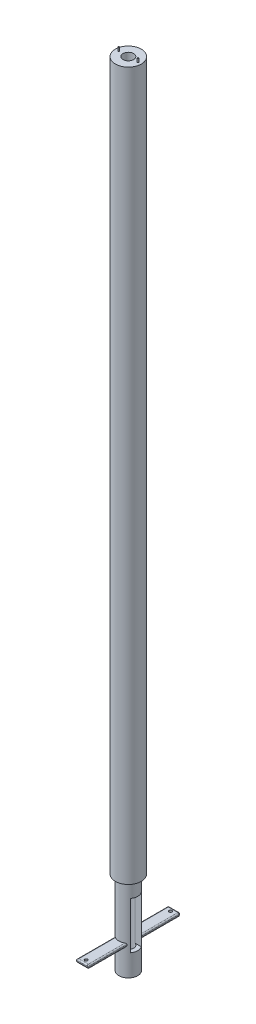
from build123d import *

# Parameters (mm, degrees)
SWEEP3_PROFILE_R         = 4
SWEEP4_PROFILE_R         = 5.5
SKETCH45_R               = 2.25
CUT_EXTRUDE2_DEPTH       = 337.377466094
SWEEP5_PROFILE_R         = 0.25
SWEEP6_PROFILE_R         = 0.25
SKETCH72_W               = 4.5
SKETCH72_H               = 20
CUT_EXTRUDE6_DEPTH       = 20
BOSS_EXTRUDE1_DEPTH      = 2.5
BOSS_EXTRUDE1_DEPTH_BACK = 2.5
BOSS_EXTRUDE3_DEPTH      = 2.5
BOSS_EXTRUDE3_DEPTH_BACK = 2.5
SKETCH76_4_W             = 16.5
SKETCH76_4_H             = 1.4
SKETCH77_R               = 0.612238256
CUT_EXTRUDE7_DEPTH       = 20
FILLET1_R                = 0.5
CUT_EXTRUDE9_DEPTH       = 3
CUT_EXTRUDE9_DEPTH_BACK  = 3


with BuildPart() as part:
    # Sweep3: sweep along a path in Sketch31
    with BuildLine(Plane.XY) as sweep3_path:
        Line((0, 0), (0, 35.470165431))
    # Sweep3 profile (on start of the path) → Sweep3 (sweep)
    with BuildSketch(Plane.ZX):
        Circle(SWEEP3_PROFILE_R)
    sweep(path=sweep3_path.line)

    # Sweep4: sweep along a path in Sketch38
    with BuildLine(Plane.XY) as sweep4_path:
        Line((0, 35.470165431), (0, 336.287525335))
    # Sweep4 profile (on start of the path) → Sweep4 (sweep)
    with BuildSketch(Plane.ZX.offset(35.470165431)):
        Circle(SWEEP4_PROFILE_R)
    sweep(path=sweep4_path.line)

    # Sketch45 → Cut-Extrude2 (cut, through all)
    with BuildSketch(Plane(origin=(0, 0, 0), x_dir=(1, 0, 0), z_dir=(0, 1, 0))):
        Circle(SKETCH45_R)
    extrude(amount=CUT_EXTRUDE2_DEPTH, mode=Mode.SUBTRACT)

    # Sweep5: sweep along a curve in space
    with BuildLine() as sweep5_path:
        Line((4.125, 336.287525335, 5.531e-06), (4.125, 337.787525335, 5.531e-06))
    # Sweep5 profile (on start of the path) → Sweep5 (sweep)
    with BuildSketch(Plane(origin=(4.125, 336.287525335, 5.531e-06), x_dir=(0, 0, 1), z_dir=(0, 1, 0))):
        Circle(SWEEP5_PROFILE_R)
    sweep(path=sweep5_path.line)

    # Sweep6: sweep along a curve in space
    with BuildLine() as sweep6_path:
        Line((-4.125, 336.287525335, 9.31e-07), (-4.125, 337.787525335, 9.31e-07))
    # Sweep6 profile (on start of the path) → Sweep6 (sweep)
    with BuildSketch(Plane(origin=(-4.125, 336.287525335, 9.31e-07), x_dir=(0, 0, 1), z_dir=(0, 1, 0))):
        Circle(SWEEP6_PROFILE_R)
    sweep(path=sweep6_path.line)

    # Sketch72 → Cut-Extrude6 (cut)
    with BuildSketch(Plane(origin=(0, 0, 0), x_dir=(0, 0, -1), z_dir=(1, 0, 0))):
        with Locations((-0.068000409, 19.236124066)):
            Rectangle(SKETCH72_W, SKETCH72_H)
    extrude(amount=CUT_EXTRUDE6_DEPTH, mode=Mode.SUBTRACT)

    # Sketch76 → Boss-Extrude1 (add, two sides: drawn at the far end of the back side and taken through both)
    with BuildSketch(Plane(origin=(0, 0, 0), x_dir=(0, 0, -1), z_dir=(1, 0, 0)).offset(-BOSS_EXTRUDE1_DEPTH_BACK)):
        Polygon((-3, 12.070165431), (-3, 12.770165431), (-19.5, 12.770165431), (-19.5, 12.370165431), (-19.5, 11.370165431), (-3, 11.370165431), align=None)
    extrude(amount=BOSS_EXTRUDE1_DEPTH + BOSS_EXTRUDE1_DEPTH_BACK)

    # Sketch76<4> → Boss-Extrude3 (add, two sides: drawn at the far end of the back side and taken through both)
    with BuildSketch(Plane(origin=(0, 0, 0), x_dir=(0, 0, -1), z_dir=(1, 0, 0)).offset(-BOSS_EXTRUDE3_DEPTH_BACK)):
        with Locations((11.25, 12.070165431)):
            Rectangle(SKETCH76_4_W, SKETCH76_4_H)
    extrude(amount=BOSS_EXTRUDE3_DEPTH + BOSS_EXTRUDE3_DEPTH_BACK)

    # Sketch77 → Cut-Extrude7 (cut)
    with BuildSketch(Plane(origin=(0, 0, 0), x_dir=(1, 0, 0), z_dir=(0, 1, 0))):
        with Locations((0, 17.9)):
            Circle(SKETCH77_R)
        with Locations((0, -17.9)):
            Circle(SKETCH77_R)
    extrude(amount=CUT_EXTRUDE7_DEPTH, mode=Mode.SUBTRACT)

    # Fillet1
    fillet1_edges = [part.edges().sort_by_distance(p)[0] for p in [
        (-2.5, 12.770165431, 11.3112495),
        (-2.5, 11.370165431, 11.3112495),
        (2.5, 12.070165431, 19.5),
        (0, 11.370165431, 19.5),
        (2.5, 11.370165431, 11.3112495),
        (2.5, 12.770165431, 11.3112495),
        (0, 12.770165431, 19.5),
        (-2.5, 11.370165431, -11.3112495),
        (-2.5, 12.770165431, -11.3112495),
        (0, 12.770165431, -19.5),
        (0, 11.370165431, -19.5),
        (2.5, 12.070165431, -19.5),
        (2.5, 11.370165431, -11.3112495),
        (2.5, 12.770165431, -11.3112495),
    ]]
    fillet(fillet1_edges, radius=FILLET1_R)

    # Sketch81 → Cut-Extrude9 (cut, two sides: drawn at the far end of the back side and taken through both)
    with BuildSketch(Plane.XY.offset(-CUT_EXTRUDE9_DEPTH_BACK)):
        Polygon((-3.370825875, 247.178368204), (-51.601612029, 269.074039778), (-3.592025731, 269.074039778), (-3.592025731, 274.074039778), (-49.327088533, 274.074039778), (-55.247485048, 261.387475818), (-3.370825875, 237.178368204), align=None)
    extrude(amount=CUT_EXTRUDE9_DEPTH + CUT_EXTRUDE9_DEPTH_BACK, mode=Mode.SUBTRACT)


solid = part.part
